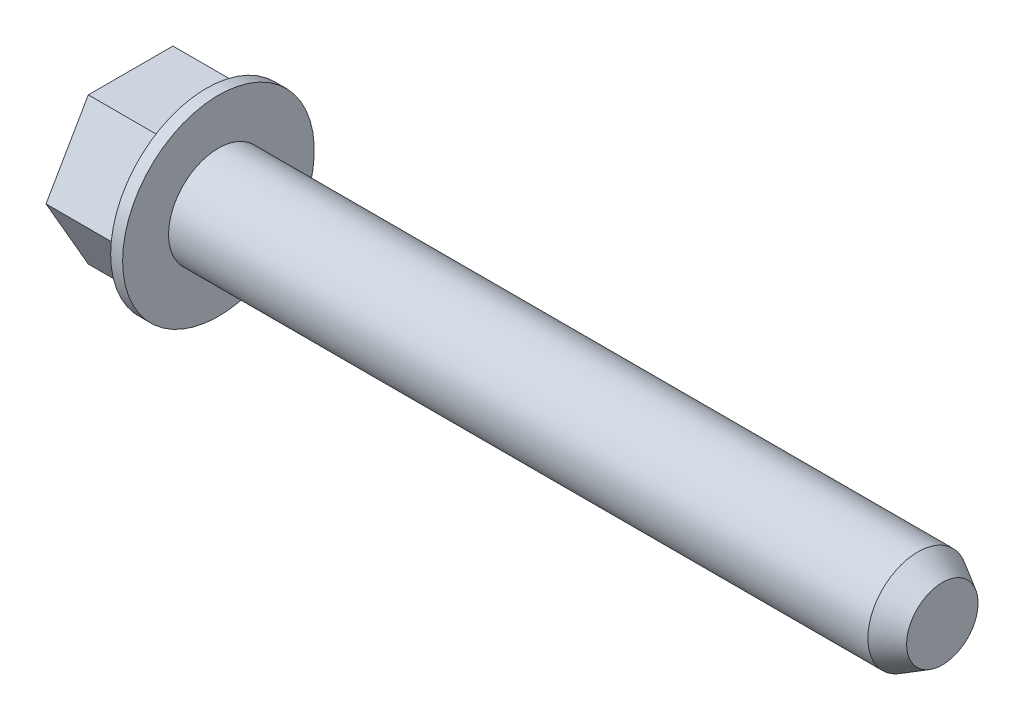
from build123d import *

# Parameters (mm, degrees)
EXTRUDE1_REACH = 54.353


with BuildPart() as part:
    # Sketch1 → base-Revolve (revolve)
    with BuildSketch(Plane.XY, mode=Mode.PRIVATE) as base_revolve_sk:
        Polygon((0, 6.096), (-0.762, 6.096), (-0.762, 4.6609), (-5.588, 4.6609), (-5.588, 3.72872), (-4.6228, 3.72872), (-4.6228, 0), (0, 0), (46.0502, 0), (46.0502, 3.175), (0, 3.175), align=None)
    revolve(base_revolve_sk.sketch.rotate(Axis((0, 0, 0), (1, 0, 0)), 90), axis=Axis((0, 0, 0), (1, 0, 0)))

    # Sketch15 → Extrude1 (add, up to next)
    with BuildSketch(Plane.ZY.offset(5.588), mode=Mode.PRIVATE) as extrude1_sk1:
        with BuildLine():
            ThreePointArc((-4.036457824, -2.330449967), (-4.6609, 3.6e-08), (-4.036457787, 2.33045003))
            Line((-4.036457787, 2.33045003), (-5.381943739, 0))
            Line((-5.381943739, 0), (-4.036457824, -2.330449967))
        make_face()
    extrude1_tool1 = extrude(extrude1_sk1.sketch, amount=-EXTRUDE1_REACH, mode=Mode.PRIVATE) - part.part
    # Sketch15 → Extrude1 (add, up to next)
    with BuildSketch(Plane.ZY.offset(5.588), mode=Mode.PRIVATE) as extrude1_sk2:
        with BuildLine():
            ThreePointArc((-4.036457787, 2.33045003), (-2.330449985, 4.036457813), (0, 4.6609))
            Line((0, 4.6609), (-2.69097187, 4.6609))
            Line((-2.69097187, 4.6609), (-4.036457787, 2.33045003))
        make_face()
    extrude1_tool2 = extrude(extrude1_sk2.sketch, amount=-EXTRUDE1_REACH, mode=Mode.PRIVATE) - part.part
    # Sketch15 → Extrude1 (add, up to next)
    with BuildSketch(Plane.ZY.offset(5.588), mode=Mode.PRIVATE) as extrude1_sk3:
        with BuildLine():
            ThreePointArc((0, 4.6609), (2.330450001, 4.036457804), (4.036457805, 2.330449998))
            Line((4.036457805, 2.330449998), (2.69097187, 4.6609))
            Line((2.69097187, 4.6609), (0, 4.6609))
        make_face()
    extrude1_tool3 = extrude(extrude1_sk3.sketch, amount=-EXTRUDE1_REACH, mode=Mode.PRIVATE) - part.part
    # Sketch15 → Extrude1 (add, up to next)
    with BuildSketch(Plane.ZY.offset(5.588), mode=Mode.PRIVATE) as extrude1_sk4:
        with BuildLine():
            Line((4.036457776, -2.330450049), (5.381943739, 0))
            Line((5.381943739, 0), (4.036457805, 2.330449998))
            ThreePointArc((4.036457805, 2.330449998), (4.502083684, 1.206329686), (4.6609, 0))
            ThreePointArc((4.6609, 0), (4.502083676, -1.206329715), (4.036457776, -2.330450049))
        make_face()
    extrude1_tool4 = extrude(extrude1_sk4.sketch, amount=-EXTRUDE1_REACH, mode=Mode.PRIVATE) - part.part
    # Sketch15 → Extrude1 (add, up to next)
    with BuildSketch(Plane.ZY.offset(5.588), mode=Mode.PRIVATE) as extrude1_sk5:
        with BuildLine():
            Line((2.69097187, -4.6609), (4.036457776, -2.330450049))
            ThreePointArc((4.036457776, -2.330450049), (2.330449975, -4.036457819), (0, -4.6609))
            Line((0, -4.6609), (2.69097187, -4.6609))
        make_face()
    extrude1_tool5 = extrude(extrude1_sk5.sketch, amount=-EXTRUDE1_REACH, mode=Mode.PRIVATE) - part.part
    # Sketch15 → Extrude1 (add, up to next)
    with BuildSketch(Plane.ZY.offset(5.588), mode=Mode.PRIVATE) as extrude1_sk6:
        with BuildLine():
            Line((-2.69097187, -4.6609), (0, -4.6609))
            ThreePointArc((0, -4.6609), (-2.330450017, -4.036457795), (-4.036457824, -2.330449967))
            Line((-4.036457824, -2.330449967), (-2.69097187, -4.6609))
        make_face()
    extrude1_tool6 = extrude(extrude1_sk6.sketch, amount=-EXTRUDE1_REACH, mode=Mode.PRIVATE) - part.part
    add(extrude1_tool1.solids().sort_by_distance((-5.588, 0, -4.817334))[0])
    add(extrude1_tool2.solids().sort_by_distance((-5.588, 4.171933, -2.408667))[0])
    add(extrude1_tool3.solids().sort_by_distance((-5.588, 4.171933, 2.408667))[0])
    add(extrude1_tool4.solids().sort_by_distance((-5.588, 0, 4.817334))[0])
    add(extrude1_tool5.solids().sort_by_distance((-5.588, -4.171933, 2.408667))[0])
    add(extrude1_tool6.solids().sort_by_distance((-5.588, -4.171933, -2.408667))[0])

    # Sketch8 → point_Cut-Revolve1 (revolve, cut)
    with BuildSketch(Plane.XY, mode=Mode.PRIVATE) as point_cut_revolve1_sk:
        Polygon((46.0502, 0), (46.5582, 0), (46.5582, 3.683), (44.488409787, 3.683), (44.488409787, 3.175), (46.0502, 2.2733), align=None)
    revolve(point_cut_revolve1_sk.sketch.rotate(Axis((0, 0, 0), (1, 0, 0)), 90), axis=Axis((0, 0, 0), (1, 0, 0)), mode=Mode.SUBTRACT)


solid = part.part
